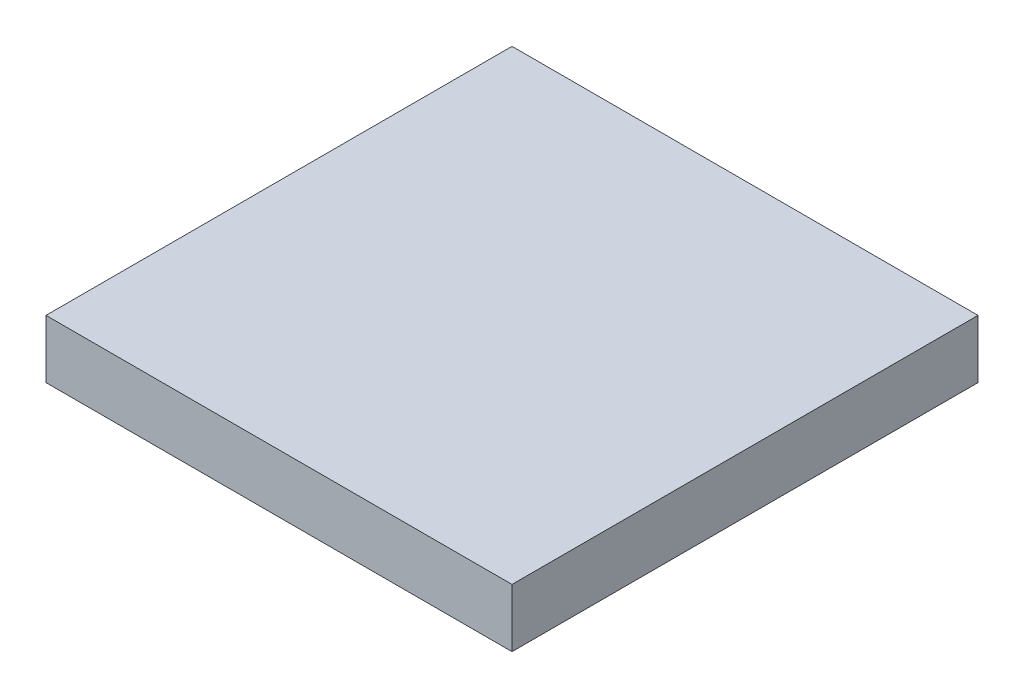
from build123d import *

# Parameters (mm, degrees)
OVEN_KARBON_FILTRE_40X40X5_OPSIYON_1_START = -100
SKETCH1_W                                  = 400
SKETCH1_H                                  = 50
OVEN_KARBON_FILTRE_40X40X5_OPSIYON_1_DEPTH = 400


with BuildPart() as part:
    # Sketch1 → OVEN_karbon_filtre_40x40x5_opsiyon_1 (new body)
    with BuildSketch(Plane.XY.offset(OVEN_KARBON_FILTRE_40X40X5_OPSIYON_1_START)):
        with Locations((350, 1825)):
            Rectangle(SKETCH1_W, SKETCH1_H)
    extrude(amount=-OVEN_KARBON_FILTRE_40X40X5_OPSIYON_1_DEPTH)


solid = part.part
